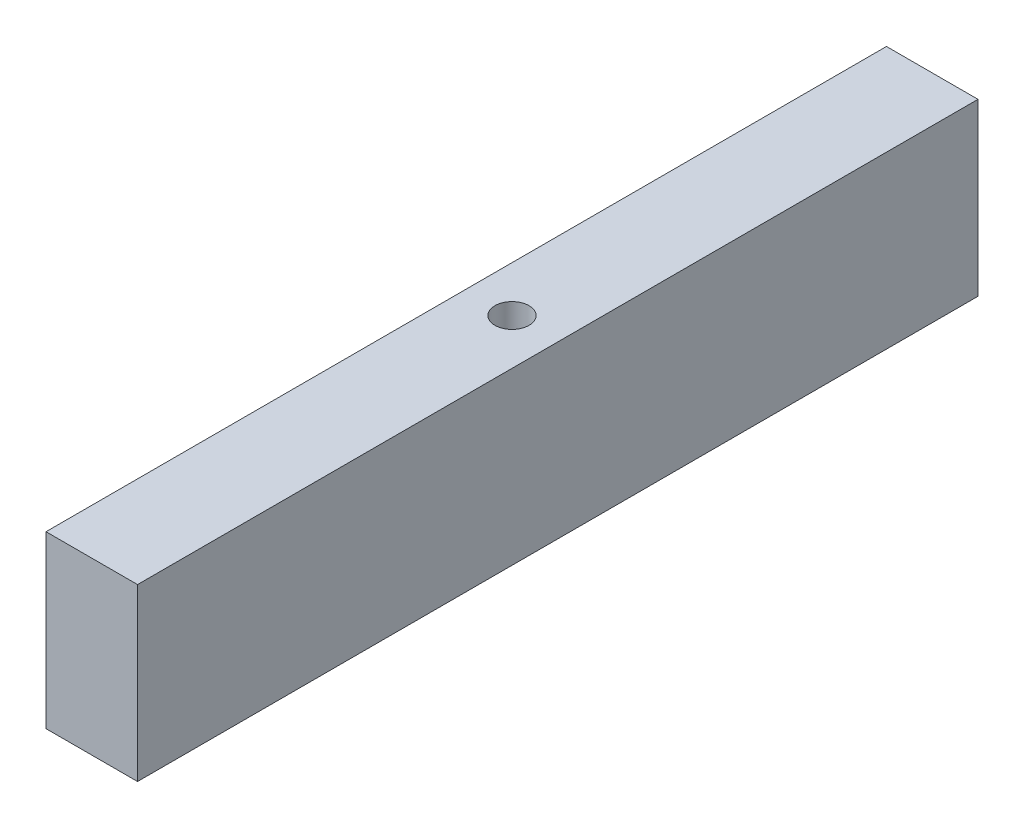
from build123d import *

# Parameters (mm, degrees)
SKETCH1_W           = 22
SKETCH1_H           = 41
BOSS_EXTRUDE1_DEPTH = 101
SKETCH2_R           = 4.1
CUT_EXTRUDE1_DEPTH  = 46


with BuildPart() as part:
    # Sketch1 → Boss-Extrude1 (new, symmetric)
    with BuildSketch(Plane.XY):
        with Locations((0, 20.5)):
            Rectangle(SKETCH1_W, SKETCH1_H)
    extrude(amount=BOSS_EXTRUDE1_DEPTH, both=True)

    # Sketch2 → Cut-Extrude1 (cut, symmetric)
    with BuildSketch(Plane(origin=(0, 0, 0), x_dir=(1, 0, 0), z_dir=(0, 1, 0))):
        with Locations(Location((0, 0, 0), (0, 0, 270))):
            Circle(SKETCH2_R)
    extrude(amount=CUT_EXTRUDE1_DEPTH, both=True, mode=Mode.SUBTRACT)


solid = part.part
